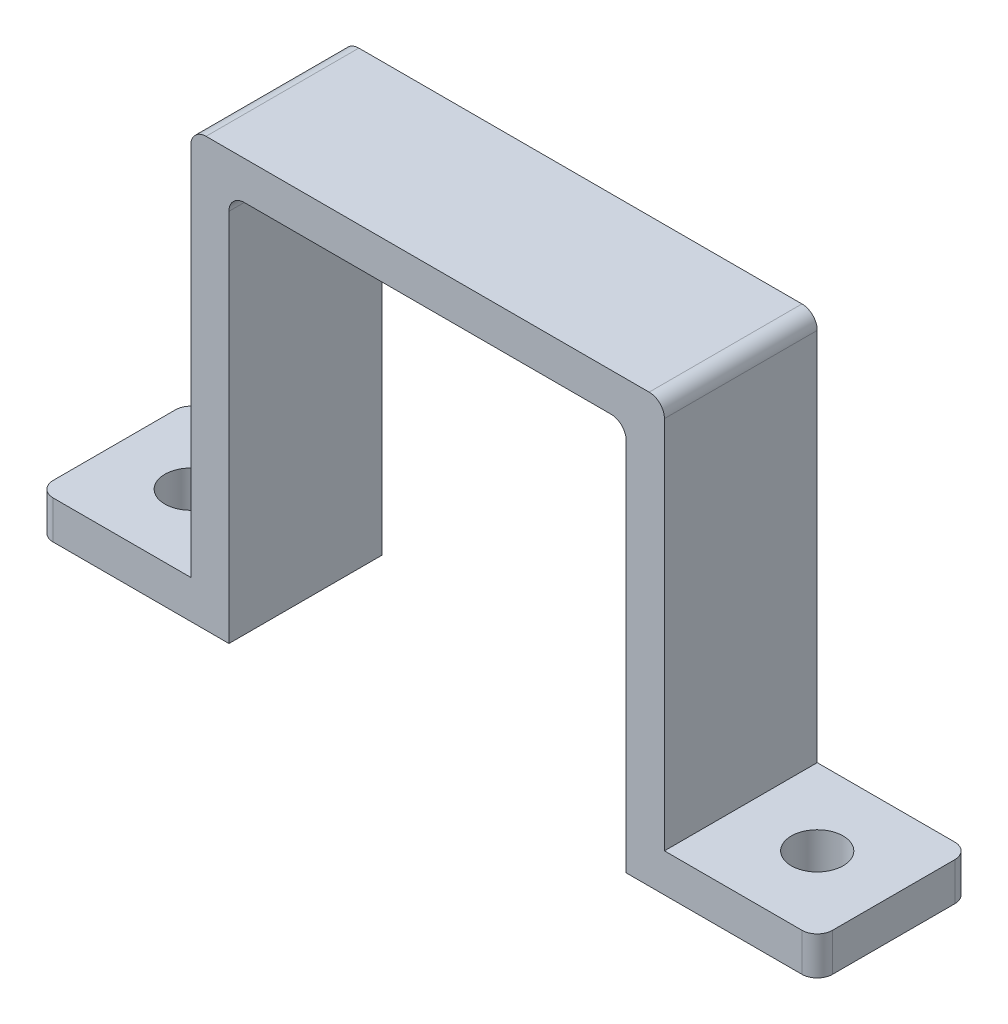
from build123d import *

# Parameters (mm, degrees)
BOSS_EXTRUDE1_DEPTH   = 12.7
F_6_CLEARANCE_HOLE1_D = 4.3053
FILLET1_R             = 1.27


with BuildPart() as part:
    # Sketch1 → Boss-Extrude1 (new body)
    with BuildSketch(Plane.XY):
        Polygon((-15.875, 0), (0, 0), (0, 32.385), (33.02, 32.385), (33.02, 0), (48.895, 0), (48.895, 3.175), (36.195, 3.175), (36.195, 35.56), (-3.175, 35.56), (-3.175, 3.175), (-15.875, 3.175), align=None)
    extrude(amount=BOSS_EXTRUDE1_DEPTH)

    # #6 Clearance Hole1 (through all)
    with Locations(Plane(origin=(0, 3.175, 0), x_dir=(1, 0, 0), z_dir=(0, 1, 0))):
        with Locations((-9.525, -6.35), (42.545, -6.35)):
            Hole(F_6_CLEARANCE_HOLE1_D / 2)

    # Fillet1
    fillet1_edges = [part.edges().sort_by_distance(p)[0] for p in [
        (48.895, 1.5875, 0),
        (-15.875, 1.5875, 0),
        (-3.175, 35.56, 6.35),
        (36.195, 35.56, 6.35),
        (33.02, 32.385, 6.35),
        (0, 32.385, 6.35),
        (48.895, 1.5875, 12.7),
        (-15.875, 1.5875, 12.7),
    ]]
    fillet(fillet1_edges, radius=FILLET1_R)


solid = part.part
